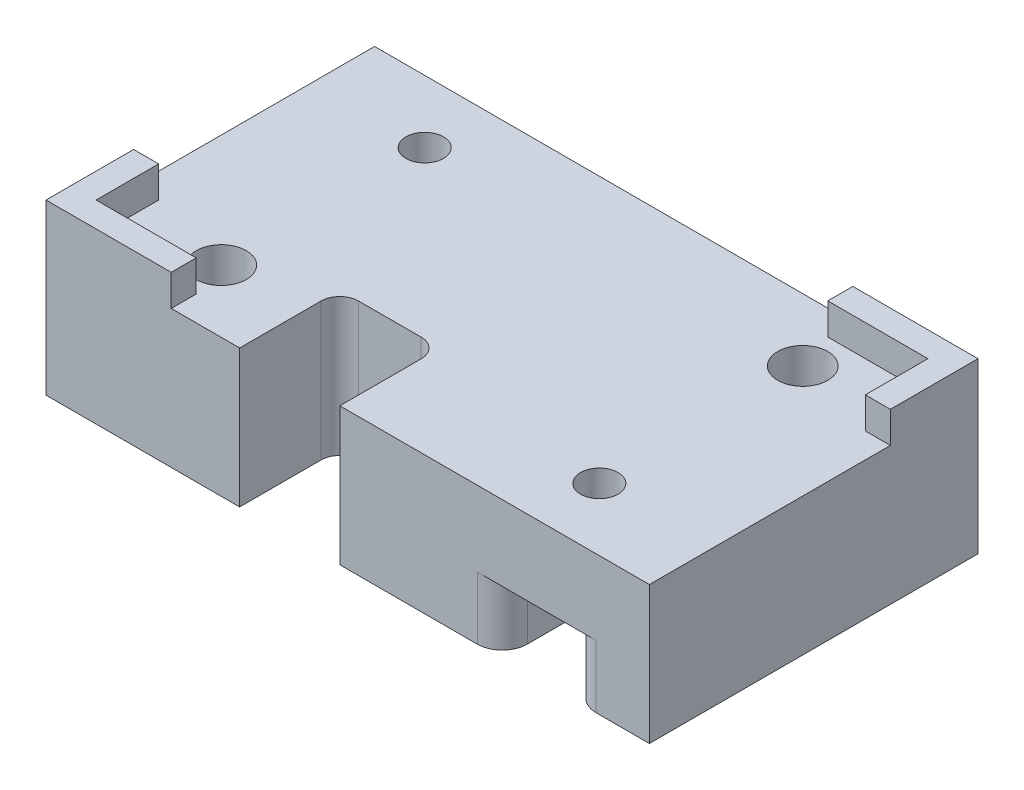
from build123d import *

# Parameters (mm, degrees)
SKETCH1_W           = 48.2
SKETCH1_H           = 26.25
SKETCH1_R           = 1.5
SKETCH1_R_2         = 2
BOSS_EXTRUDE1_DEPTH = 11
BOSS_EXTRUDE2_DEPTH = 2.5
SKETCH3_W           = 8
SKETCH3_H           = 8
CUT_EXTRUDE1_DEPTH  = 30.564769997
FILLET1_R           = 1.5
CUT_EXTRUDE2_DEPTH  = 5
FILLET2_R           = 2


with BuildPart() as part:
    # Sketch1 → Boss-Extrude1 (new body)
    with BuildSketch(Plane(origin=(0, 0, 0), x_dir=(1, 0, 0), z_dir=(0, 1, 0))):
        Rectangle(SKETCH1_W, SKETCH1_H)
        with Locations(Location((-15.1, 8.125, 0), (0, 0, 270))):
            Circle(SKETCH1_R, mode=Mode.SUBTRACT)
        with Locations(Location((15.1, -8.125, 0), (0, 0, 270))):
            Circle(SKETCH1_R, mode=Mode.SUBTRACT)
        with Locations(Location((-15.1, -8.125, 0), (0, 0, 270))):
            Circle(SKETCH1_R_2, mode=Mode.SUBTRACT)
        with Locations(Location((15.1, 8.125, 0), (0, 0, 270))):
            Circle(SKETCH1_R_2, mode=Mode.SUBTRACT)
    extrude(amount=BOSS_EXTRUDE1_DEPTH)

    # Sketch2 → Boss-Extrude2 (add)
    with BuildSketch(Plane(origin=(0, 11, 0), x_dir=(1, 0, 0), z_dir=(0, 1, 0))):
        Polygon((-24.1, -6.125), (-22.1, -6.125), (-22.1, -11.125), (-14.1, -11.125), (-14.1, -13.125), (-24.1, -13.125), align=None)
        Polygon((14.1, 13.125), (14.1, 11.125), (22.1, 11.125), (22.1, 6.125), (24.1, 6.125), (24.1, 13.125), align=None)
    extrude(amount=BOSS_EXTRUDE2_DEPTH)

    # Sketch3 → Cut-Extrude1 (cut, through all)
    with BuildSketch(Plane(origin=(0, 11, 0), x_dir=(1, 0, 0), z_dir=(0, 1, 0))):
        with Locations((-4.63, -9.125)):
            Rectangle(SKETCH3_W, SKETCH3_H)
    extrude(amount=-CUT_EXTRUDE1_DEPTH, mode=Mode.SUBTRACT)

    # Fillet1
    fillet1_edges = [part.edges().sort_by_distance(p)[0] for p in [
        (-8.63, 5.5, 5.125),
        (-0.63, 5.5, 5.125),
    ]]
    fillet(fillet1_edges, radius=FILLET1_R)

    # Sketch5 → Cut-Extrude2 (cut)
    with BuildSketch(Plane.XZ):
        Polygon((-17.85, -9.71271324), (-17.85, -13.125), (-12.35, -13.125), (-12.35, -9.71271324), (-12.35, -6.53728676), (-15.1, -4.949573519), (-17.85, -6.53728676), align=None)
        Polygon((15.1, 4.949573519), (17.85, 6.53728676), (17.85, 9.71271324), (17.85, 13.125), (12.35, 13.125), (12.35, 9.71271324), (12.35, 6.53728676), align=None)
    extrude(amount=-CUT_EXTRUDE2_DEPTH, mode=Mode.SUBTRACT)

    # Fillet2
    fillet2_edges = [part.edges().sort_by_distance(p)[0] for p in [
        (-12.35, 2.5, -13.125),
        (-17.85, 2.5, -13.125),
        (12.35, 2.5, 13.125),
        (17.85, 2.5, 13.125),
    ]]
    fillet(fillet2_edges, radius=FILLET2_R)


solid = part.part
